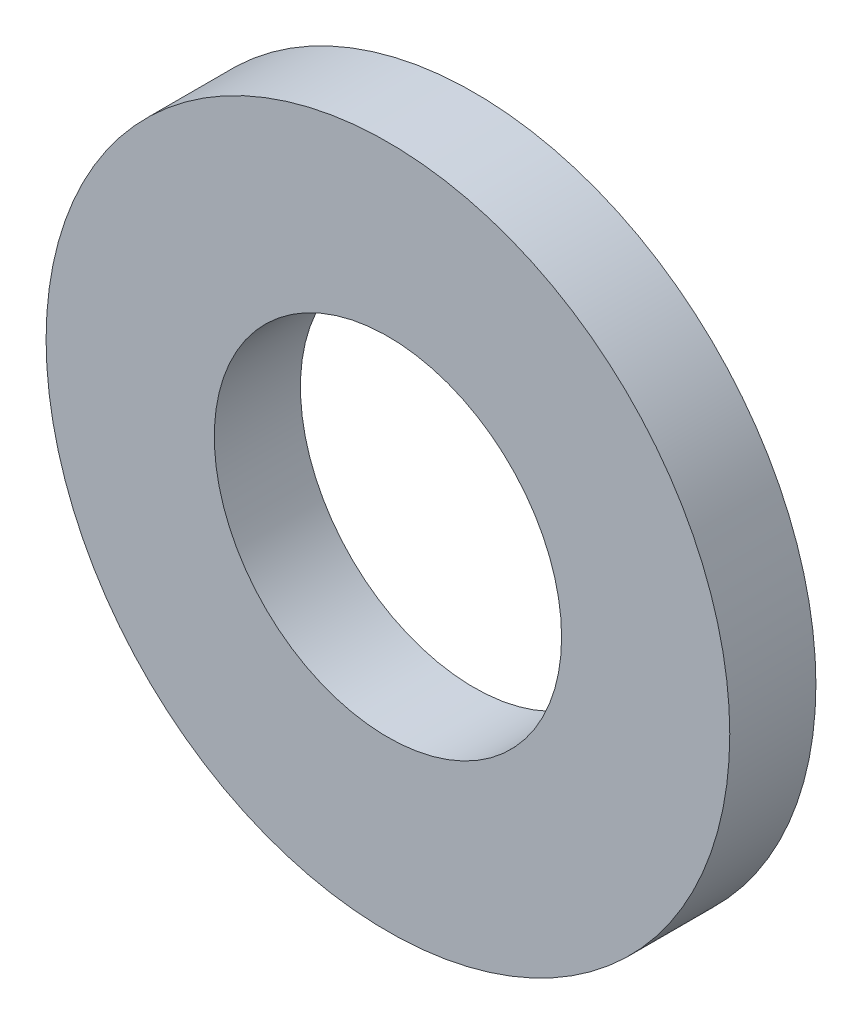
from build123d import *

# Parameters (mm, degrees)
SKETCH1_R           = 6.35
SKETCH1_R_2         = 3.2258
BOSS_EXTRUDE1_DEPTH = 1.6


with BuildPart() as part:
    # Sketch1 → Boss-Extrude1 (new body)
    with BuildSketch(Plane.XY):
        Circle(SKETCH1_R)
        Circle(SKETCH1_R_2, mode=Mode.SUBTRACT)
    extrude(amount=BOSS_EXTRUDE1_DEPTH)


solid = part.part
